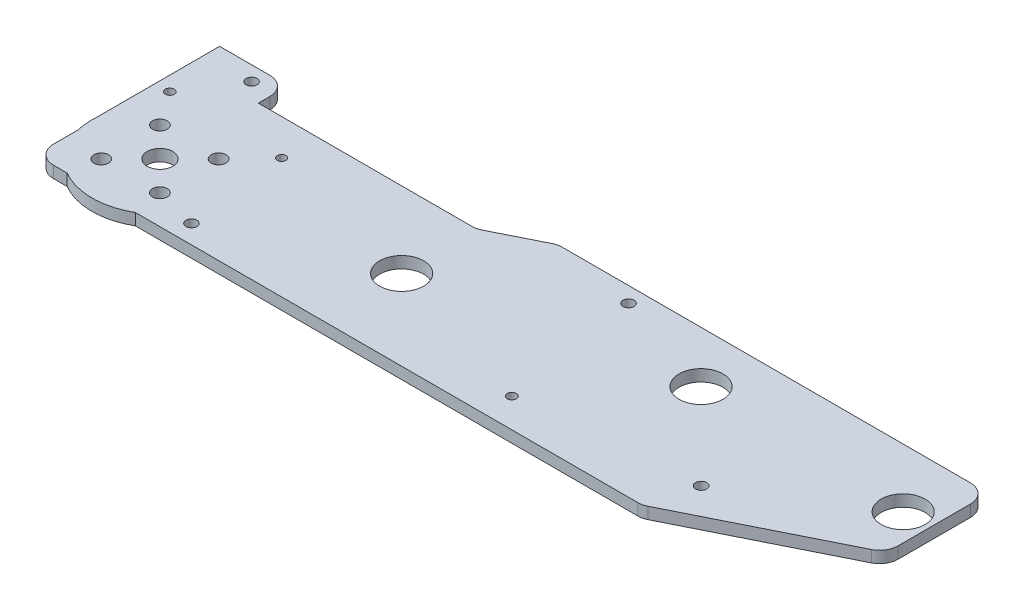
from build123d import *

# Parameters (mm, degrees)
SKETCH1_W           = 210
SKETCH1_H           = 50
SKETCH1_R           = 1.211665018
SKETCH1_R_2         = 1.165617118
SKETCH1_R_3         = 1.5
SKETCH1_R_4         = 1.25
SKETCH1_R_5         = 1.517273905
SKETCH1_R_6         = 3.4
BOSS_EXTRUDE1_DEPTH = 3.175
SKETCH2_R           = 2
CUT_EXTRUDE1_DEPTH  = 10
SKETCH3_R           = 6
SKETCH3_R_2         = 0.586995366
CUT_EXTRUDE2_DEPTH  = 57.15
CUT_EXTRUDE7_DEPTH  = 10
FILLET3_R           = 5
SKETCH11_R          = 18.5
SKETCH11_R_2        = 2
BOSS_EXTRUDE4_DEPTH = 3.175
SKETCH16_W          = 18.257640281
SKETCH16_H          = 3.175
BOSS_EXTRUDE7_DEPTH = 8.128
SKETCH17_W          = 33.3
SKETCH17_H          = 3.175
BOSS_EXTRUDE8_DEPTH = 35.56
SKETCH18_R          = 2
CUT_EXTRUDE8_DEPTH  = 9
SKETCH19_R          = 4
CUT_EXTRUDE9_DEPTH  = 40
FILLET4_R           = 5
SKETCH20_R          = 3.5
CUT_EXTRUDE10_DEPTH = 10
SKETCH21_R          = 1.5
CUT_EXTRUDE11_DEPTH = 10
SKETCH22_R          = 1.5
CUT_EXTRUDE12_DEPTH = 10
SKETCH24_R          = 1.5
CUT_EXTRUDE13_DEPTH = 10
SKETCH25_W          = 49.782255358
SKETCH25_H          = 46.410966041
CUT_EXTRUDE14_DEPTH = 10


with BuildPart() as part:
    # Sketch1 → Boss-Extrude1 (new body)
    with BuildSketch(Plane(origin=(0, 0, 0), x_dir=(1, 0, 0), z_dir=(0, 1, 0))):
        with Locations((105, -25)):
            Rectangle(SKETCH1_W, SKETCH1_H)
        with Locations(Location((3.489526233, -16.787661112, 0), (0, 0, 270))):
            Circle(SKETCH1_R, mode=Mode.SUBTRACT)
        with Locations(Location((34.37258772, -17.194005245, 0), (0, 0, 270))):
            Circle(SKETCH1_R_2, mode=Mode.SUBTRACT)
        with Locations(Location((37.520749958, -44.921198121, 0), (0, 0, 270))):
            Circle(SKETCH1_R_3, mode=Mode.SUBTRACT)
        with Locations(Location((122, -42.058139805, 0), (0, 0, 270))):
            Circle(SKETCH1_R_4, mode=Mode.SUBTRACT)
        with Locations(Location((168.975233936, -37.403209633, 0), (0, 0, 270))):
            Circle(SKETCH1_R_5, mode=Mode.SUBTRACT)
        with Locations(Location((18, -34, 0), (0, 0, 270))):
            Circle(SKETCH1_R_6, mode=Mode.SUBTRACT)
    extrude(amount=BOSS_EXTRUDE1_DEPTH)

    # Sketch2 → Cut-Extrude1 (cut)
    with BuildSketch(Plane(origin=(0, 3.175, 0), x_dir=(1, 0, 0), z_dir=(0, 1, 0))):
        with Locations(Location((10, -26, 0), (0, 0, 270))):
            Circle(SKETCH2_R)
        with Locations(Location((10, -42, 0), (0, 0, 270))):
            Circle(SKETCH2_R)
        with Locations(Location((26, -26, 0), (0, 0, 270))):
            Circle(SKETCH2_R)
        with Locations(Location((26, -42, 0), (0, 0, 270))):
            Circle(SKETCH2_R)
    extrude(amount=-CUT_EXTRUDE1_DEPTH, mode=Mode.SUBTRACT)

    # Sketch3 → Cut-Extrude2 (cut)
    with BuildSketch(Plane(origin=(0, 3.175, 0), x_dir=(1, 0, 0), z_dir=(0, 1, 0))):
        with Locations(Location((78.01026379, -28.1, 0), (0, 0, 270))):
            Circle(SKETCH3_R)
        with Locations(Location((145.531297368, -14, 0), (0, 0, 270))):
            Circle(SKETCH3_R)
        with Locations((18, -34)):
            Circle(SKETCH3_R_2)
        with Locations(Location((202.646291021, -16, 0), (0, 0, 270))):
            Circle(SKETCH3_R)
    extrude(amount=-CUT_EXTRUDE2_DEPTH, mode=Mode.SUBTRACT)

    # Sketch10 → Cut-Extrude7 (cut)
    with BuildSketch(Plane(origin=(0, 3.175, 0), x_dir=(1, 0, 0), z_dir=(0, 1, 0))):
        Polygon((210, -27.859435908), (165.502877994, -50), (210, -50), align=None)
        Polygon((92.532613397, 0), (77.65477062, -7.402812063), (0, -7.402812063), (0, 0), align=None)
    extrude(amount=-CUT_EXTRUDE7_DEPTH, mode=Mode.SUBTRACT)

    # Fillet3
    fillet3_edges = [part.edges().sort_by_distance(p)[0] for p in [
        (210, 1.5875, 0),
        (92.532613397, 1.5875, 0),
        (210, 1.5875, 27.859435908),
        (165.502877994, 1.5875, 50),
        (77.65477062, 1.5875, 7.402812063),
    ]]
    fillet(fillet3_edges, radius=FILLET3_R)

    # Sketch11 → Boss-Extrude4 (add)
    with BuildSketch(Plane(origin=(0, 3.175, 0), x_dir=(1, 0, 0), z_dir=(0, 1, 0))):
        with Locations((18, -34)):
            Circle(SKETCH11_R)
        with Locations(Location((10, -26, 0), (0, 0, 270))):
            Circle(SKETCH11_R_2, mode=Mode.SUBTRACT)
        with Locations(Location((10, -42, 0), (0, 0, 270))):
            Circle(SKETCH11_R_2, mode=Mode.SUBTRACT)
        with Locations(Location((26, -26, 0), (0, 0, 270))):
            Circle(SKETCH11_R_2, mode=Mode.SUBTRACT)
        with Locations(Location((26, -42, 0), (0, 0, 270))):
            Circle(SKETCH11_R_2, mode=Mode.SUBTRACT)
    extrude(amount=-BOSS_EXTRUDE4_DEPTH)

    # Sketch16 → Boss-Extrude7 (add)
    with BuildSketch(Plane(origin=(0, 0, 7.402812063), x_dir=(-1, 0, 0), z_dir=(0, 0, -1))):
        with Locations((-9.128820141, 1.5875)):
            Rectangle(SKETCH16_W, SKETCH16_H)
    extrude(amount=BOSS_EXTRUDE7_DEPTH)

    # Sketch17 → Boss-Extrude8 (add)
    with BuildSketch(Plane.ZY):
        with Locations((15.924812063, 1.5875)):
            Rectangle(SKETCH17_W, SKETCH17_H)
    extrude(amount=BOSS_EXTRUDE8_DEPTH)

    # Sketch18 → Cut-Extrude8 (cut)
    with BuildSketch(Plane(origin=(0, 3.175, 0), x_dir=(1, 0, 0), z_dir=(0, 1, 0))):
        with Locations(Location((-29.612034681, -23.798543698, 0), (0, 0, 270))):
            Circle(SKETCH18_R)
        with Locations(Location((-29.359661767, -7.798707515, 0), (0, 0, 270))):
            Circle(SKETCH18_R)
        with Locations(Location((-13.359825583, -8.051080428, 0), (0, 0, 270))):
            Circle(SKETCH18_R)
        with Locations(Location((-13.612198497, -24.050916612, 0), (0, 0, 270))):
            Circle(SKETCH18_R)
    extrude(amount=-CUT_EXTRUDE8_DEPTH, mode=Mode.SUBTRACT)

    # Sketch19 → Cut-Extrude9 (cut)
    with BuildSketch(Plane(origin=(0, 3.175, 0), x_dir=(1, 0, 0), z_dir=(0, 1, 0))):
        with Locations(Location((-21.359661767, -15.798707515, 0), (0, 0, 270))):
            Circle(SKETCH19_R)
    extrude(amount=-CUT_EXTRUDE9_DEPTH, mode=Mode.SUBTRACT)

    # Fillet4
    fillet4_edges = [part.edges().sort_by_distance(p)[0] for p in [
        (18.257640281, 1.5875, -0.725187937),
        (-35.56, 1.5875, -0.725187937),
        (-35.56, 1.5875, 32.574812063),
        (0, 1.5875, 50),
    ]]
    fillet(fillet4_edges, radius=FILLET4_R)

    # Sketch20 → Cut-Extrude10 (cut)
    with BuildSketch(Plane(origin=(0, 3.175, 0), x_dir=(1, 0, 0), z_dir=(0, 1, 0))):
        with Locations(Location((18, -34, 0), (0, 0, 270))):
            Circle(SKETCH20_R)
    extrude(amount=-CUT_EXTRUDE10_DEPTH, mode=Mode.SUBTRACT)

    # Sketch21 → Cut-Extrude11 (cut)
    with BuildSketch(Plane(origin=(0, 3.175, 0), x_dir=(1, 0, 0), z_dir=(0, 1, 0))):
        with Locations(Location((116, -4.237214774, 0), (0, 0, 270))):
            Circle(SKETCH21_R)
    extrude(amount=-CUT_EXTRUDE11_DEPTH, mode=Mode.SUBTRACT)

    # Sketch22 → Cut-Extrude12 (cut)
    with BuildSketch(Plane(origin=(0, 3.175, 0), x_dir=(1, 0, 0), z_dir=(0, 1, 0))):
        with Locations(Location((12.257640281, -3.274812063, 0), (0, 0, 270))):
            Circle(SKETCH22_R)
    extrude(amount=-CUT_EXTRUDE12_DEPTH, mode=Mode.SUBTRACT)

    # Sketch24 → Cut-Extrude13 (cut)
    with BuildSketch(Plane(origin=(0, 3.175, 0), x_dir=(1, 0, 0), z_dir=(0, 1, 0))):
        with Locations(Location((-30.56, -15.774812063, 0), (0, 0, 270))):
            Circle(SKETCH24_R)
    extrude(amount=-CUT_EXTRUDE13_DEPTH, mode=Mode.SUBTRACT)

    # Sketch25 → Cut-Extrude14 (cut)
    with BuildSketch(Plane(origin=(0, 3.175, 0), x_dir=(1, 0, 0), z_dir=(0, 1, 0))):
        with Locations((-25.336149754, -9.369329043)):
            Rectangle(SKETCH25_W, SKETCH25_H)
    extrude(amount=-CUT_EXTRUDE14_DEPTH, mode=Mode.SUBTRACT)


solid = part.part
